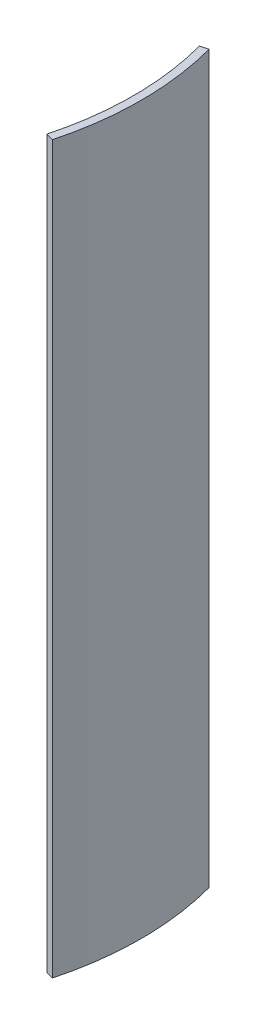
from build123d import *

# Parameters (mm, degrees)
BOSS_EXTRUDE1_DEPTH = 1800


with BuildPart() as part:
    # Sketch1 → Boss-Extrude1 (new body)
    with BuildSketch(Plane(origin=(0, 0, 0), x_dir=(1, 0, 0), z_dir=(0, 1, 0))):
        with BuildLine():
            Line((705.608816104, 189.067312447), (724.444369717, 194.114283827))
            ThreePointArc((724.444369717, 194.114283827), (750, 0), (724.444369717, -194.114283827))
            Line((724.444369717, -194.114283827), (705.608816104, -189.067312447))
            ThreePointArc((705.608816104, -189.067312447), (730.5, 0), (705.608816104, 189.067312447))
        make_face()
    extrude(amount=BOSS_EXTRUDE1_DEPTH)


solid = part.part
